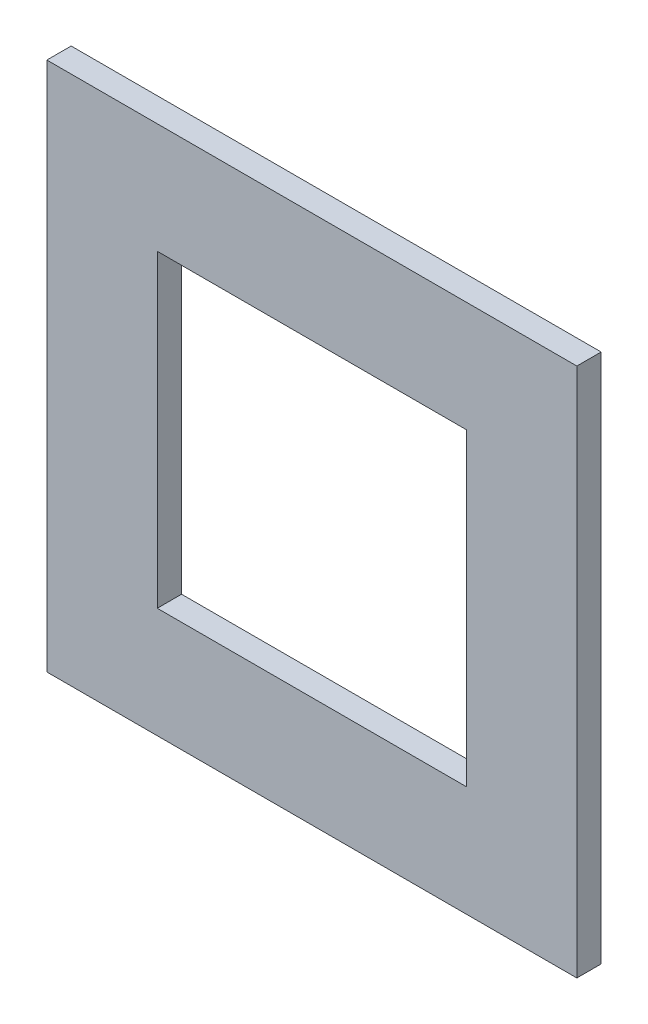
from build123d import *

# Parameters (mm, degrees)
SKETCH1_W           = 24
SKETCH1_H           = 24
SKETCH1_W_2         = 14
SKETCH1_H_2         = 14
BOSS_EXTRUDE1_DEPTH = 1.1


with BuildPart() as part:
    # Sketch1 → Boss-Extrude1 (new body)
    with BuildSketch(Plane.XY):
        Rectangle(SKETCH1_W, SKETCH1_H)
        Rectangle(SKETCH1_W_2, SKETCH1_H_2, mode=Mode.SUBTRACT)
    extrude(amount=BOSS_EXTRUDE1_DEPTH)


solid = part.part
